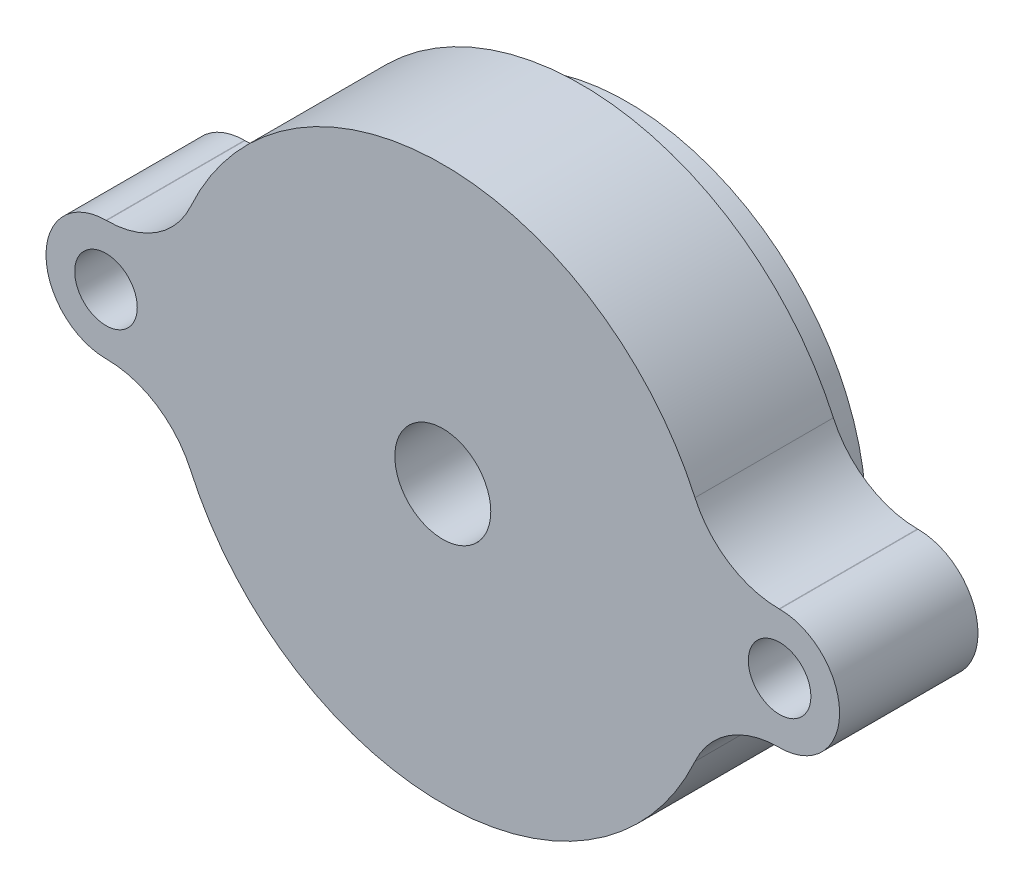
from build123d import *
from build123d.topology import SkipClean

# Parameters (mm, degrees)
BOSS_EXTRUDE1_DEPTH           = 6.35
BOSS_EXTRUDE3_DEPTH           = 6.35
BOSS_EXTRUDE3_DEPTH_BACK      = 3.175
SKETCH2_R                     = 16.4211
F_6_CLEARANCE_HOLE1_D         = 4.3053
F_6_PLASTIC_INSERT_AT_2_COUNT = 2
F_6_PLASTIC_INSERT_AT_2_PITCH = 46.355
BOSS_EXTRUDE4_REACH           = 37.634
SKETCH22_R                    = 16.4211
SKETCH22_R_2                  = 3.302


with BuildPart() as part:
    # Sketch1 → Boss-Extrude1 (new body)
    with BuildSketch(Plane.XY):
        with BuildLine():
            Line((0, 3.302), (0, 16.4211))
            ThreePointArc((0, 16.4211), (-10.552943475, 12.581252292), (-16.170566439, 2.8575))
            ThreePointArc((-16.170566439, 2.8575), (-16.4211, 0), (-16.170566439, -2.8575))
            ThreePointArc((-16.170566439, -2.8575), (-10.552943475, -12.581252292), (0, -16.4211))
            Line((0, -16.4211), (0, -3.302))
            ThreePointArc((0, -3.302), (-3.302, 0), (0, 3.302))
        make_face()
        with BuildLine():
            ThreePointArc((16.170566439, -2.8575), (16.4211, 0), (16.170566439, 2.8575))
            ThreePointArc((16.170566439, 2.8575), (10.552943475, 12.581252292), (0, 16.4211))
            Line((0, 16.4211), (0, 3.302))
            ThreePointArc((0, 3.302), (2.334866591, 2.334866591), (3.302, 0))
            ThreePointArc((3.302, 0), (2.334866591, -2.334866591), (0, -3.302))
            Line((0, -3.302), (0, -16.4211))
            ThreePointArc((0, -16.4211), (10.552943475, -12.581252292), (16.170566439, -2.8575))
        make_face()
    extrude(amount=BOSS_EXTRUDE1_DEPTH)

    # Sketch2 → Boss-Extrude3 (add, two sides: drawn at the far end of the back side and taken through both)
    with BuildSketch(Plane.XY.offset(6.35).offset(-BOSS_EXTRUDE3_DEPTH_BACK)):
        with BuildLine():
            Line((23.1775, 4.1275), (23.138323054, 4.1275))
            ThreePointArc((23.138323054, 4.1275), (19.696705066, 5.14104372), (17.35374229, 7.858125))
            ThreePointArc((17.35374229, 7.858125), (0, 19.05), (-17.35374229, 7.858125))
            ThreePointArc((-17.35374229, 7.858125), (-19.696705066, 5.14104372), (-23.138323054, 4.1275))
            Line((-23.138323054, 4.1275), (-23.1775, 4.1275))
            ThreePointArc((-23.1775, 4.1275), (-27.305, 0), (-23.1775, -4.1275))
            Line((-23.1775, -4.1275), (-23.138323054, -4.1275))
            ThreePointArc((-23.138323054, -4.1275), (-19.696705066, -5.14104372), (-17.35374229, -7.858125))
            ThreePointArc((-17.35374229, -7.858125), (0, -19.05), (17.35374229, -7.858125))
            ThreePointArc((17.35374229, -7.858125), (19.696705066, -5.14104372), (23.138323054, -4.1275))
            Line((23.138323054, -4.1275), (23.1775, -4.1275))
            ThreePointArc((23.1775, -4.1275), (27.305, 0), (23.1775, 4.1275))
        make_face()
        Circle(SKETCH2_R, mode=Mode.SUBTRACT)
    extrude(amount=BOSS_EXTRUDE3_DEPTH + BOSS_EXTRUDE3_DEPTH_BACK)

    # #6 Clearance Hole1 (through all)
    with Locations(Plane(origin=(-22.699598292, 0.104385938, 3.175), x_dir=(-1, 0, 0), z_dir=(0, 0, -1))):
        with Locations((-45.877098292, -0.104385938), (0.477901708, -0.104385938)):
            Hole(F_6_CLEARANCE_HOLE1_D / 2)

    # Sketch5 → #6 Plastic Insert (revolve, cut)
    with BuildSketch(Plane(origin=(23.1775, 0, 3.175), x_dir=(0, 1, 0), z_dir=(1, 0, 0))):
        Polygon((0, 0), (0, 3.81), (2.5273, 3.81), (2.6543, 0), align=None)
    f_6_plastic_insert = revolve(axis=Axis((23.1775, 0, 113.175), (0, 0, -1)), mode=Mode.SUBTRACT)

    # #6 Plastic Insert at 2: #6 Plastic Insert ×2
    with Locations(*[(-i * F_6_PLASTIC_INSERT_AT_2_PITCH, 0, 0) for i in range(1, F_6_PLASTIC_INSERT_AT_2_COUNT)]):
        add(f_6_plastic_insert, mode=Mode.SUBTRACT)

    # Sketch22 → Boss-Extrude4 (add, up to next)
    with BuildSketch(Plane.XY.offset(12.7), mode=Mode.PRIVATE) as boss_extrude4_sk1:
        Circle(SKETCH22_R)
        Circle(SKETCH22_R_2, mode=Mode.SUBTRACT)
    boss_extrude4_tool1 = extrude(boss_extrude4_sk1.sketch, amount=-BOSS_EXTRUDE4_REACH, mode=Mode.PRIVATE) - part.part
    add(boss_extrude4_tool1.solids().sort_by_distance((-15.956641, 0, 12.7))[0])


solid = part.part
